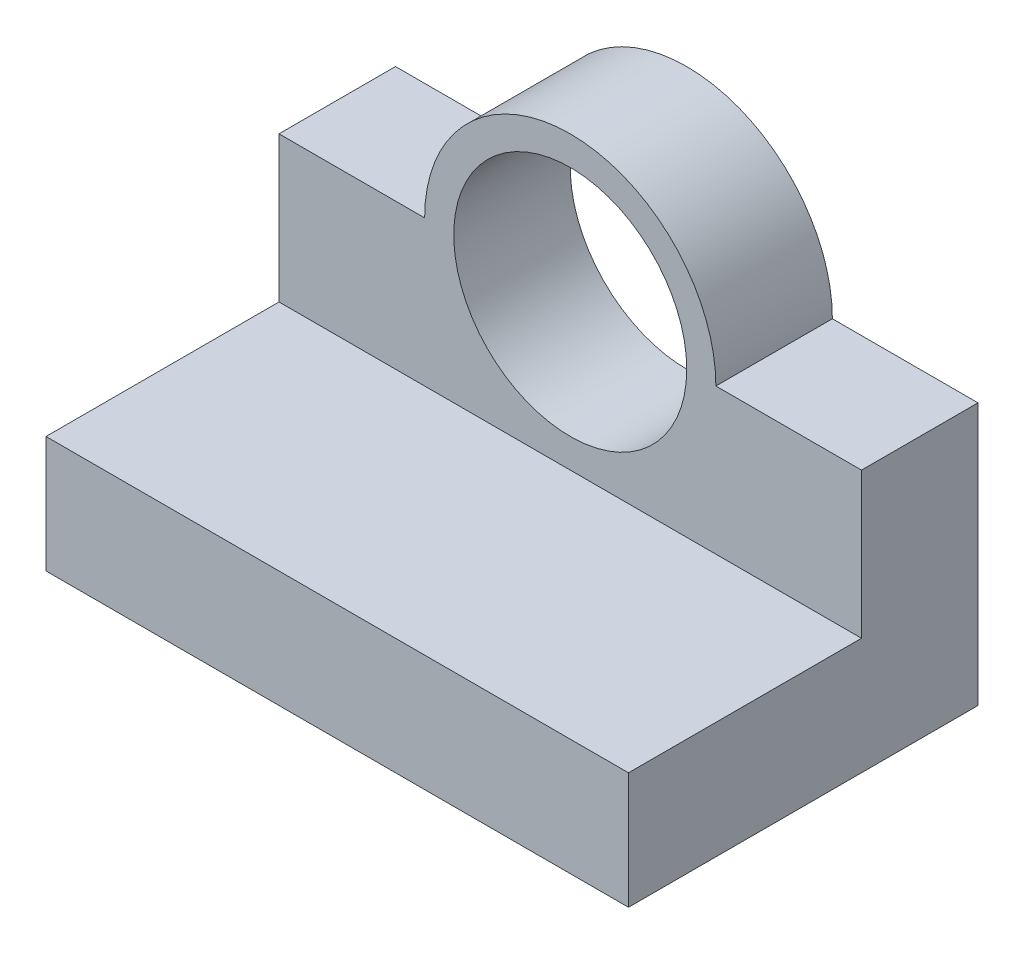
from build123d import *

# Parameters (mm, degrees)
SKETCH3_R           = 20
BOSS_EXTRUDE1_DEPTH = 10
BOSS_EXTRUDE2_START = -20
SKETCH5_W           = 100
SKETCH5_H           = 20
BOSS_EXTRUDE2_DEPTH = 60


with BuildPart() as part:
    # Sketch3 → Boss-Extrude1 (new, symmetric)
    with BuildSketch(Plane.XY):
        with BuildLine():
            Line((25, 12.5), (50, 12.5))
            Line((50, 12.5), (50, -12.5))
            Line((50, -12.5), (-50, -12.5))
            Line((-50, -12.5), (-50, 12.5))
            Line((-50, 12.5), (-25, 12.5))
            ThreePointArc((-25, 12.5), (0, 37.5), (25, 12.5))
        make_face()
        with Locations((0, 12.5)):
            Circle(SKETCH3_R, mode=Mode.SUBTRACT)
    extrude(amount=BOSS_EXTRUDE1_DEPTH, both=True)

    # Sketch5 → Boss-Extrude2 (add)
    with BuildSketch(Plane.XY.offset(10).offset(BOSS_EXTRUDE2_START)):
        with Locations((0, -22.5)):
            Rectangle(SKETCH5_W, SKETCH5_H)
    extrude(amount=BOSS_EXTRUDE2_DEPTH)


solid = part.part
